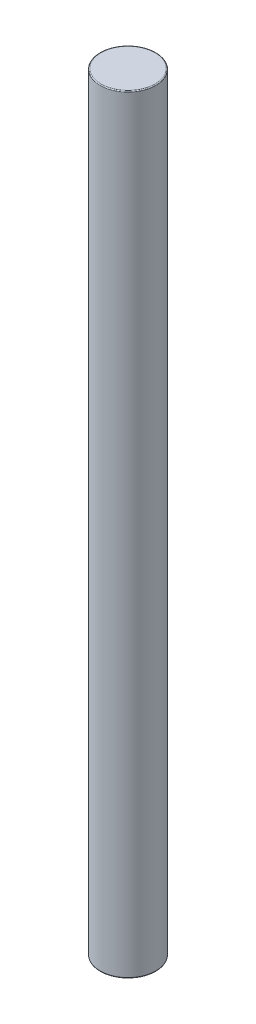
from build123d import *

# Parameters (mm, degrees)
SKETCH1_R           = 6
BOSS_EXTRUDE1_DEPTH = 82.5
FILLET1_R           = 0.2


with BuildPart() as part:
    # Sketch1 → Boss-Extrude1 (new, symmetric)
    with BuildSketch(Plane(origin=(0, 0, 0), x_dir=(1, 0, 0), z_dir=(0, 1, 0))):
        with Locations(Location((0, 0, 0), (0, 0, 270))):
            Circle(SKETCH1_R)
    extrude(amount=BOSS_EXTRUDE1_DEPTH, both=True)

    # Fillet1
    fillet1_edges = [part.edges().sort_by_distance(p)[0] for p in [
        (0, -82.5, -6),
        (0, 82.5, -6),
    ]]
    fillet(fillet1_edges, radius=FILLET1_R)


solid = part.part
